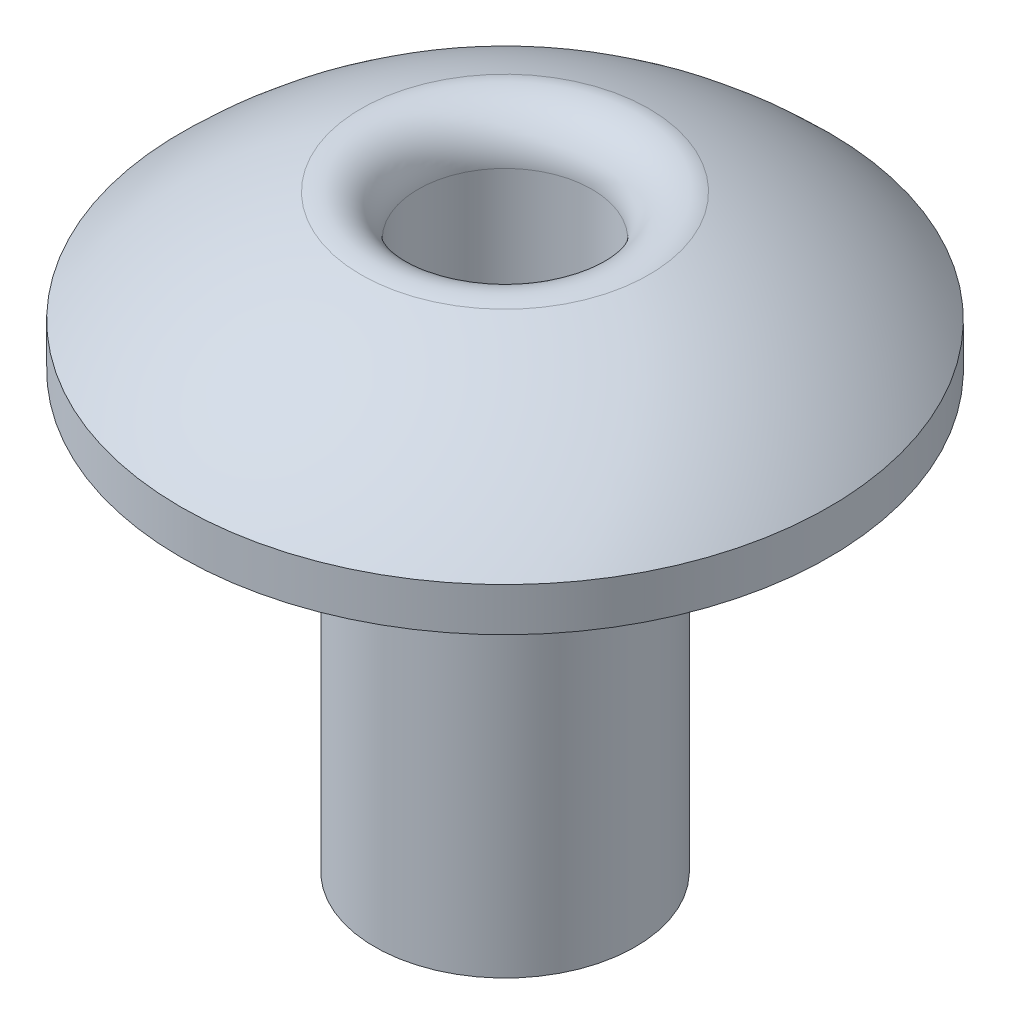
from build123d import *

# Parameters (mm, degrees)
SKETCH3_R           = 1.5
BOSS_EXTRUDE1_DEPTH = 5
SKETCH4_R           = 1
CUT_EXTRUDE1_DEPTH  = 9.801880823
FILLET1_R           = 0.5


with BuildPart() as part:
    # Sketch2 → Revolve2 (revolve)
    with BuildSketch(Plane(origin=(0, 0, 0), x_dir=(0, 0, -1), z_dir=(1, 0, 0))):
        with BuildLine():
            Line((0, 1.54531685), (0, 0))
            Line((0, 0), (0, -0.5))
            Line((0, -0.5), (-3.730724896, -0.5))
            Line((-3.730724896, -0.5), (-3.730724896, 0))
            ThreePointArc((-3.730724896, 0), (-2.019053765, 1.143702085), (0, 1.54531685))
        make_face()
    revolve(axis=Axis((0, -0.5, 0), (0, 1, 0)))

    # Sketch3 → Boss-Extrude1 (add)
    with BuildSketch(Plane.XZ.offset(0.5)):
        with Locations(Location((0, 0, 0), (0, 0, 270))):
            Circle(SKETCH3_R)
    extrude(amount=BOSS_EXTRUDE1_DEPTH)

    # Sketch4 → Cut-Extrude1 (cut, through all)
    with BuildSketch(Plane.XZ.offset(5.5)):
        with Locations(Location((0, 0, 0), (0, 0, 270))):
            Circle(SKETCH4_R)
    extrude(amount=-CUT_EXTRUDE1_DEPTH, mode=Mode.SUBTRACT)

    # Fillet1
    fillet1_edges = [part.edges().sort_by_distance(p)[0] for p in [
        (1, 1.449682086, 0),
    ]]
    fillet(fillet1_edges, radius=FILLET1_R)


solid = part.part
